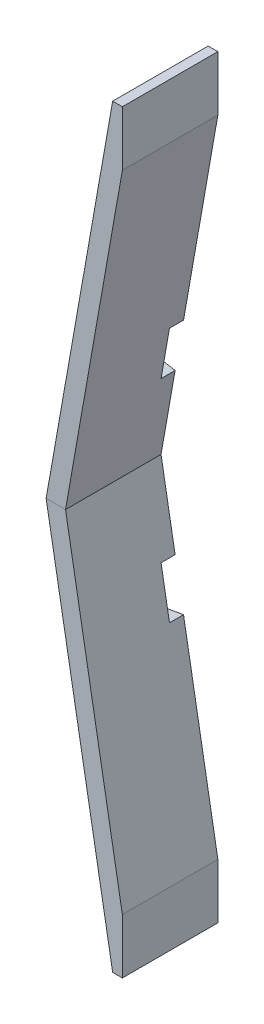
from build123d import *

# Parameters (mm, degrees)
BOSS_EXTRUDE1_DEPTH = 20
SKETCH2_W           = 2.94
SKETCH2_H           = 10.16
CUT_EXTRUDE1_DEPTH  = 68.159900875


with BuildPart() as part:
    # Sketch1 → Boss-Extrude1 (new body)
    with BuildSketch(Plane.XY):
        Polygon((-94.899446982, -0.347296355), (-81.030853224, -79), (-79, -79), (-79, -67.482459034), (-90.898978252, 0), (-92.929831476, 0), (-94.9606847, 0), align=None)
    extrude(amount=-BOSS_EXTRUDE1_DEPTH)

    # Sketch2 → Cut-Extrude1 (cut, through all)
    with BuildSketch(Plane(origin=(-92.097269688, -16.239233496, 0), x_dir=(0, 0, 1), z_dir=(-0.9848077530122071, -0.17364817766693633, 0))):
        with Locations((-18.53, -6.260250152)):
            Rectangle(SKETCH2_W, SKETCH2_H)
    extrude(amount=-CUT_EXTRUDE1_DEPTH, mode=Mode.SUBTRACT)


with BuildPart() as body_2:
    # Mirror2: mirrored copy
    add(part.part.mirror(Plane.ZX))


solid = Compound([part.part, body_2.part])
